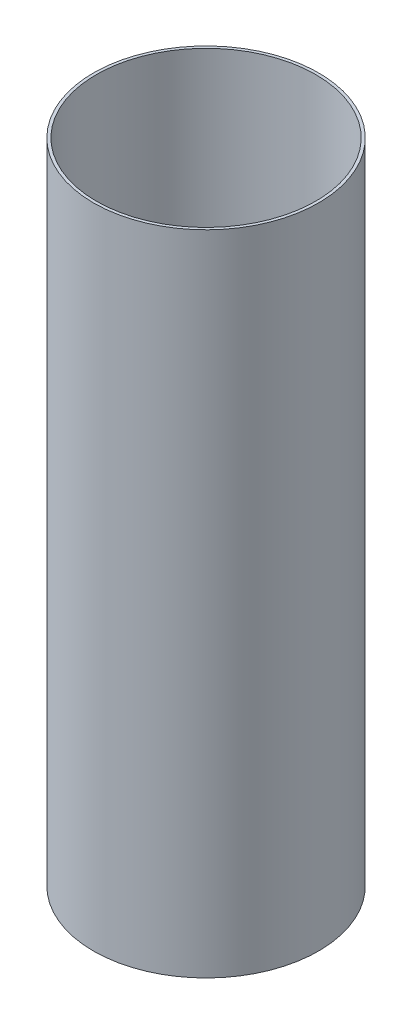
from build123d import *

# Parameters (mm, degrees)
SKETCH1_R           = 78.2
SKETCH1_R_2         = 76.2
BOSS_EXTRUDE1_DEPTH = 450


with BuildPart() as part:
    # Sketch1 → Boss-Extrude1 (new body)
    with BuildSketch(Plane(origin=(0, 0, 0), x_dir=(1, 0, 0), z_dir=(0, 1, 0))):
        with Locations(Location((0, 0, 0), (0, 0, 270))):
            Circle(SKETCH1_R)
        with Locations(Location((0, 0, 0), (0, 0, 270))):
            Circle(SKETCH1_R_2, mode=Mode.SUBTRACT)
    extrude(amount=BOSS_EXTRUDE1_DEPTH)


solid = part.part
